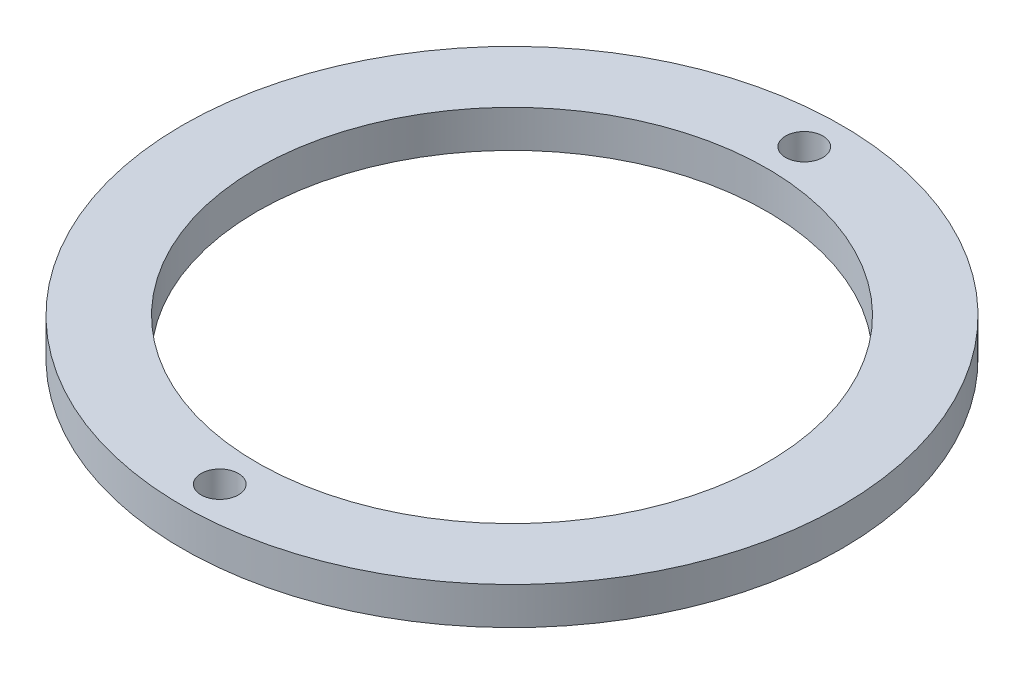
from build123d import *

# Parameters (mm, degrees)
SKETCH_1_W          = 6
SKETCH_1_H          = 3
SKETCH_2_R          = 1.5
CUT_EXTRUDE_1_DEPTH = 10


with BuildPart() as part:
    # Эскиз1 → Повернуть1 (revolve)
    with BuildSketch(Plane.XY, mode=Mode.PRIVATE) as revolve_1_sk:
        with Locations((23.5, 37.1)):
            Rectangle(SKETCH_1_W, SKETCH_1_H)
    revolve(revolve_1_sk.sketch.rotate(Axis((0, 55.88945234, 0), (0, -1, 0)), 180), axis=Axis((0, 55.88945234, 0), (0, -1, 0)))

    # Эскиз2 → Вырез-Вытянуть1 (cut)
    with BuildSketch(Plane(origin=(0, 38.6, 0), x_dir=(1, 0, 0), z_dir=(0, 1, 0))):
        with Locations(Location((0, -23.5, 0), (0, 0, 180))):
            Circle(SKETCH_2_R)
        with Locations(Location((0, 23.5, 0), (0, 0, 180))):
            Circle(SKETCH_2_R)
    extrude(amount=-CUT_EXTRUDE_1_DEPTH, mode=Mode.SUBTRACT)


solid = part.part
